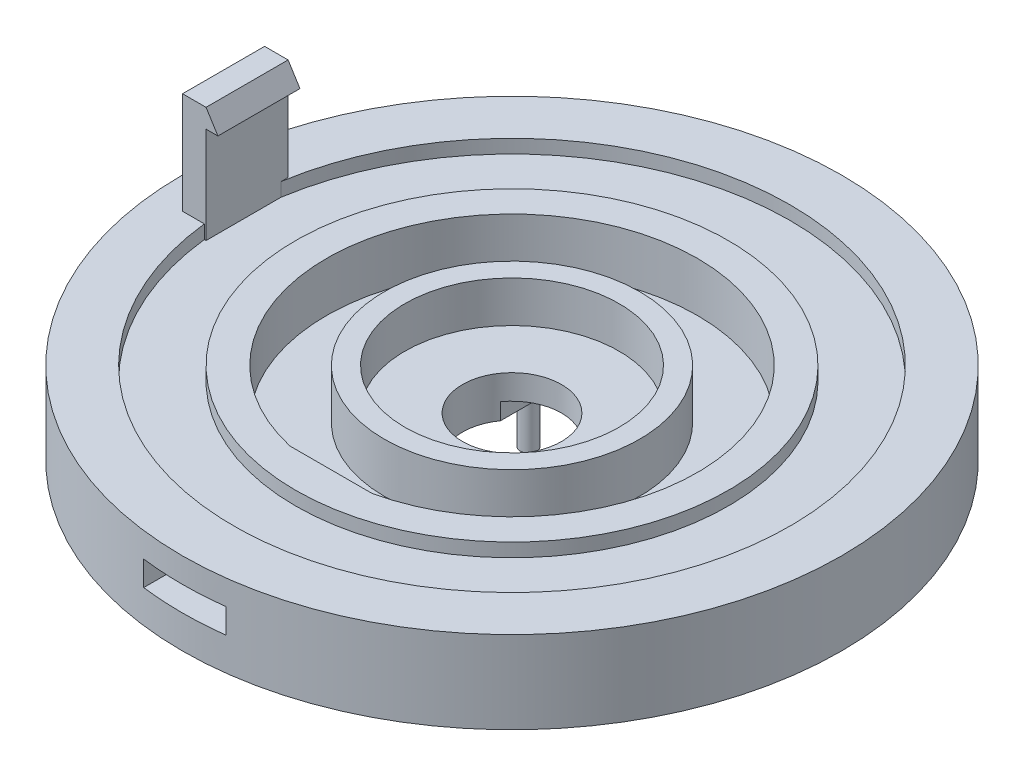
from build123d import *

# Parameters (mm, degrees)
SKETCH28_W                                   = 80
SKETCH28_H                                   = 80
BOSS_EXTRUDE1_DEPTH                          = 10
CBORE_FOR_M10_CHEESE_HEAD_SCREW1_D           = 12
CBORE_FOR_M10_CHEESE_HEAD_SCREW1_CBORE_D     = 26
CBORE_FOR_M10_CHEESE_HEAD_SCREW1_CBORE_DEPTH = 5
SKETCH36_R                                   = 1
BOSS_EXTRUDE5_DEPTH                          = 10
SKETCH37_R                                   = 22.5
SKETCH37_R_2                                 = 15.5
CUT_EXTRUDE2_DEPTH                           = 6
CUT_EXTRUDE6_DEPTH                           = 6
SKETCH40_W                                   = 18.062589032
SKETCH40_H                                   = 3
BOSS_EXTRUDE7_DEPTH                          = 13
SKETCH41_R                                   = 33.75
SKETCH41_R_2                                 = 26.25
CUT_EXTRUDE7_DEPTH                           = 1.65
SKETCH42_W                                   = 9.8
SKETCH42_H                                   = 11.037342061
CUT_EXTRUDE8_DEPTH                           = 2
CUT_EXTRUDE11_DEPTH                          = 20
SKETCH45_W                                   = 2.851047628
SKETCH45_H                                   = 9.955339391
BOSS_EXTRUDE8_DEPTH                          = 14
BOSS_EXTRUDE9_DEPTH                          = 9.955336


with BuildPart() as part:
    # Sketch28 → Boss-Extrude1 (new body)
    with BuildSketch(Plane(origin=(0, 0, 0), x_dir=(1, 0, 0), z_dir=(0, 1, 0))):
        with Locations((1.944585414, 4.241283073)):
            Rectangle(SKETCH28_W, SKETCH28_H)
    extrude(amount=BOSS_EXTRUDE1_DEPTH)

    # CBORE for M10 Cheese Head Screw1 (through all)
    with Locations(Plane(origin=(0, 10, 0), x_dir=(1, 0, 0), z_dir=(0, 1, 0))):
        with Locations((1.944585414, 4.241283073)):
            CounterBoreHole(CBORE_FOR_M10_CHEESE_HEAD_SCREW1_D / 2, CBORE_FOR_M10_CHEESE_HEAD_SCREW1_CBORE_D / 2, CBORE_FOR_M10_CHEESE_HEAD_SCREW1_CBORE_DEPTH)

    # Sketch36 → Boss-Extrude5 (add)
    with BuildSketch(Plane.XZ):
        with Locations(Location((12.444585414, -16.741283073, 0), (0, 0, 270))):
            Circle(SKETCH36_R)
        with Locations(Location((12.444585414, -4.241283073, 0), (0, 0, 270))):
            Circle(SKETCH36_R)
        with Locations(Location((-8.555414586, -16.741283073, 0), (0, 0, 90))):
            Circle(SKETCH36_R)
        with Locations(Location((-8.555414586, -4.241283073, 0), (0, 0, 90))):
            Circle(SKETCH36_R)
    extrude(amount=BOSS_EXTRUDE5_DEPTH)

    # Sketch37 → Cut-Extrude2 (cut)
    with BuildSketch(Plane(origin=(0, 10, 0), x_dir=(1, 0, 0), z_dir=(0, 1, 0))):
        with Locations(Location((1.944585414, 4.241283073, 0), (0, 0, 270))):
            Circle(SKETCH37_R)
        with Locations(Location((1.944585414, 4.241283073, 0), (0, 0, 270))):
            Circle(SKETCH37_R_2, mode=Mode.SUBTRACT)
    extrude(amount=-CUT_EXTRUDE2_DEPTH, mode=Mode.SUBTRACT)

    # Sketch39 → Cut-Extrude6 (cut)
    with BuildSketch(Plane(origin=(0, 10, 0), x_dir=(1, 0, 0), z_dir=(0, 1, 0))):
        with BuildLine():
            Line((6.944585414, -35.758716927), (6.944585414, -17.696127895))
            ThreePointArc((6.944585414, -17.696127895), (1.944585414, -18.258716927), (-3.055414586, -17.696127895))
            Line((-3.055414586, -17.696127895), (-3.055414586, -35.758716927))
            Line((-3.055414586, -35.758716927), (1.944585414, -35.758716927))
            Line((1.944585414, -35.758716927), (6.944585414, -35.758716927))
        make_face()
    extrude(amount=-CUT_EXTRUDE6_DEPTH, mode=Mode.SUBTRACT)

    # Sketch40 → Boss-Extrude7 (add)
    with BuildSketch(Plane(origin=(-3.055414586, 0, 0), x_dir=(0, 0, -1), z_dir=(1, 0, 0))):
        with Locations((-26.727422411, 8.5)):
            Rectangle(SKETCH40_W, SKETCH40_H)
    extrude(amount=BOSS_EXTRUDE7_DEPTH)

    # Sketch41 → Cut-Extrude7 (cut)
    with BuildSketch(Plane(origin=(0, 10, 0), x_dir=(1, 0, 0), z_dir=(0, 1, 0))):
        with Locations(Location((1.944585414, 4.241283073, 0), (0, 0, 270))):
            Circle(SKETCH41_R)
        with Locations(Location((1.944585414, 4.241283073, 0), (0, 0, 270))):
            Circle(SKETCH41_R_2, mode=Mode.SUBTRACT)
    extrude(amount=-CUT_EXTRUDE7_DEPTH, mode=Mode.SUBTRACT)

    # Sketch42 → Cut-Extrude8 (cut)
    with BuildSketch(Plane.XZ):
        with Locations((1.966640169, -13.109663986)):
            Rectangle(SKETCH42_W, SKETCH42_H)
    extrude(amount=-CUT_EXTRUDE8_DEPTH, mode=Mode.SUBTRACT)

    # Sketch43 → Cut-Extrude11 (cut)
    with BuildSketch(Plane(origin=(0, 10, 0), x_dir=(1, 0, 0), z_dir=(0, 1, 0))):
        with BuildLine():
            ThreePointArc((-38.055414586, 4.241282966), (-26.339685871, 32.525554283), (1.944585414, 44.241283073))
            Line((1.944585414, 44.241283073), (-38.055414586, 44.241283073))
            Line((-38.055414586, 44.241283073), (-38.055414586, 4.241282966))
        make_face()
        with BuildLine():
            ThreePointArc((1.944585414, -35.758716927), (-26.339685795, -24.042988212), (-38.055414586, 4.241282966))
            Line((-38.055414586, 4.241282966), (-38.055414586, -35.758716927))
            Line((-38.055414586, -35.758716927), (1.944585414, -35.758716927))
        make_face()
        with BuildLine():
            Line((41.944585414, -35.758716927), (41.944585414, 4.241283073))
            ThreePointArc((41.944585414, 4.241283073), (30.228856662, -24.042988174), (1.944585414, -35.758716927))
            Line((1.944585414, -35.758716927), (41.944585414, -35.758716927))
        make_face()
        with BuildLine():
            Line((41.944585414, 44.241283073), (1.944585414, 44.241283073))
            ThreePointArc((1.944585414, 44.241283073), (30.228856662, 32.525554321), (41.944585414, 4.241283073))
            Line((41.944585414, 4.241283073), (41.944585414, 44.241283073))
        make_face()
    extrude(amount=-CUT_EXTRUDE11_DEPTH, mode=Mode.SUBTRACT)

    # Sketch45 → Boss-Extrude8 (add)
    with BuildSketch(Plane(origin=(0, 8.35, 0), x_dir=(1, 0, 0), z_dir=(0, 1, 0))):
        with Locations((-32.810971356, 5.43037333)):
            Rectangle(SKETCH45_W, SKETCH45_H)
    extrude(amount=BOSS_EXTRUDE8_DEPTH)

    # Sketch46 → Boss-Extrude9 (add)
    with BuildSketch(Plane.XY.offset(-0.452703634)):
        Polygon((-31.385447542, 22.35), (-31.385447542, 20.057188555), (-29.944471524, 20.057188555), align=None)
    extrude(amount=-BOSS_EXTRUDE9_DEPTH)


solid = part.part
